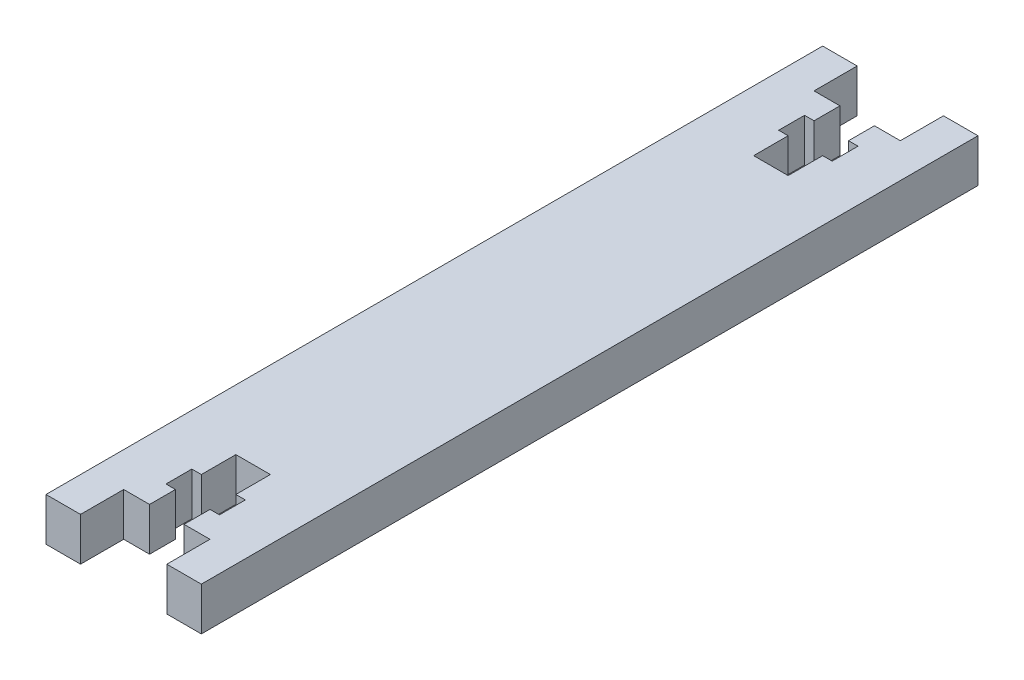
from build123d import *

# Parameters (mm, degrees)
BOSS_EXTRUDE2_DEPTH = 5


with BuildPart() as part:
    # Sketch1 → Boss-Extrude2 (new body)
    with BuildSketch(Plane(origin=(0, 0, 0), x_dir=(1, 0, 0), z_dir=(0, 1, 0))):
        Polygon((-5.645320197, 61.366995074), (-8.645320197, 61.366995074), (-8.645320197, 66.366995074), (-12.645320197, 66.366995074), (-12.645320197, 61.366995074), (-12.645320197, 31.366995074), (-12.645320197, 16.366995074), (-12.645320197, -3.633004926), (-12.645320197, -18.633004926), (-12.645320197, -23.633004926), (-8.645320197, -23.633004926), (-8.645320197, -18.633004926), (-5.645320197, -18.633004926), (-5.645320197, -15.633004926), (-6.745320197, -15.633004926), (-6.745320197, -12.633004926), (-5.645320197, -12.633004926), (-5.645320197, -8.633004926), (-1.645320197, -8.633004926), (-1.645320197, -12.633004926), (-0.545320197, -12.633004926), (-0.545320197, -15.633004926), (-1.645320197, -15.633004926), (-1.645320197, -18.633004926), (1.354679803, -18.633004926), (1.354679803, -23.633004926), (5.354679803, -23.633004926), (5.354679803, -18.633004926), (5.354679803, -3.633004926), (5.354679803, 16.366995074), (5.354679803, 31.366995074), (5.354679803, 61.366995074), (5.354679803, 66.366995074), (1.354679803, 66.366995074), (1.354679803, 61.366995074), (-1.645320197, 61.366995074), (-1.645320197, 58.366995074), (-0.545320197, 58.366995074), (-0.545320197, 55.366995074), (-1.645320197, 55.366995074), (-1.645320197, 51.366995074), (-5.645320197, 51.366995074), (-5.645320197, 55.366995074), (-6.745320197, 55.366995074), (-6.745320197, 58.366995074), (-5.645320197, 58.366995074), align=None)
    extrude(amount=BOSS_EXTRUDE2_DEPTH)


solid = part.part
